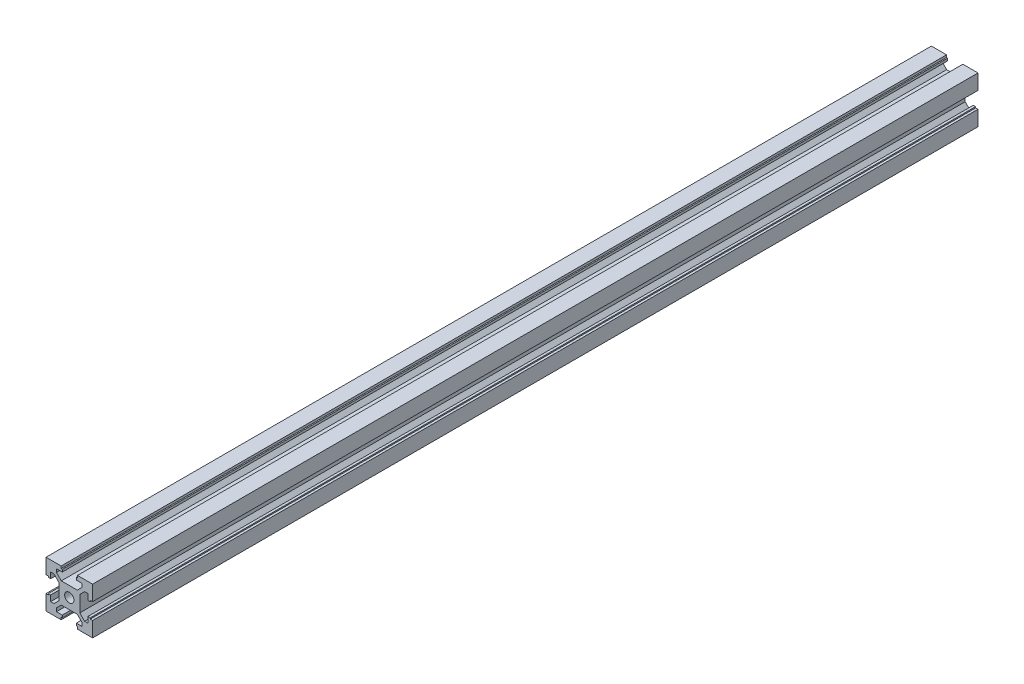
from build123d import *

# Parameters (mm, degrees)
SKETCH1_R           = 2
BOSS_EXTRUDE1_DEPTH = 380


with BuildPart() as part:
    # Sketch1 → Boss-Extrude1 (new body)
    with BuildSketch(Plane.XY):
        Polygon((-10, -10), (-3.5, -10), (-3.5, -9), (-3, -9), (-3, -8), (-5.5, -8), (-5.5, -6.560660172), (-3.44, -4.500660172), (3.44, -4.500660172), (5.5, -6.560660172), (5.5, -8), (3, -8), (3, -9), (3.5, -9), (3.5, -10), (10, -10), (10, -3.5), (9, -3.5), (9, -3), (8, -3), (8, -5.5), (6.560660172, -5.5), (4.500660172, -3.44), (4.500660172, 3.44), (6.560660172, 5.5), (8, 5.5), (8, 3), (9, 3), (9, 3.5), (10, 3.5), (10, 10), (3.5, 10), (3.5, 9), (3, 9), (3, 8), (5.5, 8), (5.5, 6.560660172), (3.44, 4.500660172), (-3.44, 4.500660172), (-5.5, 6.560660172), (-5.5, 8), (-3, 8), (-3, 9), (-3.5, 9), (-3.5, 10), (-10, 10), (-10, 3.5), (-9, 3.5), (-9, 3), (-8, 3), (-8, 5.5), (-6.560660172, 5.5), (-4.500660172, 3.44), (-4.500660172, -3.44), (-6.560660172, -5.5), (-8, -5.5), (-8, -3), (-9, -3), (-9, -3.5), (-10, -3.5), align=None)
        Circle(SKETCH1_R, mode=Mode.SUBTRACT)
    extrude(amount=BOSS_EXTRUDE1_DEPTH)


solid = part.part
